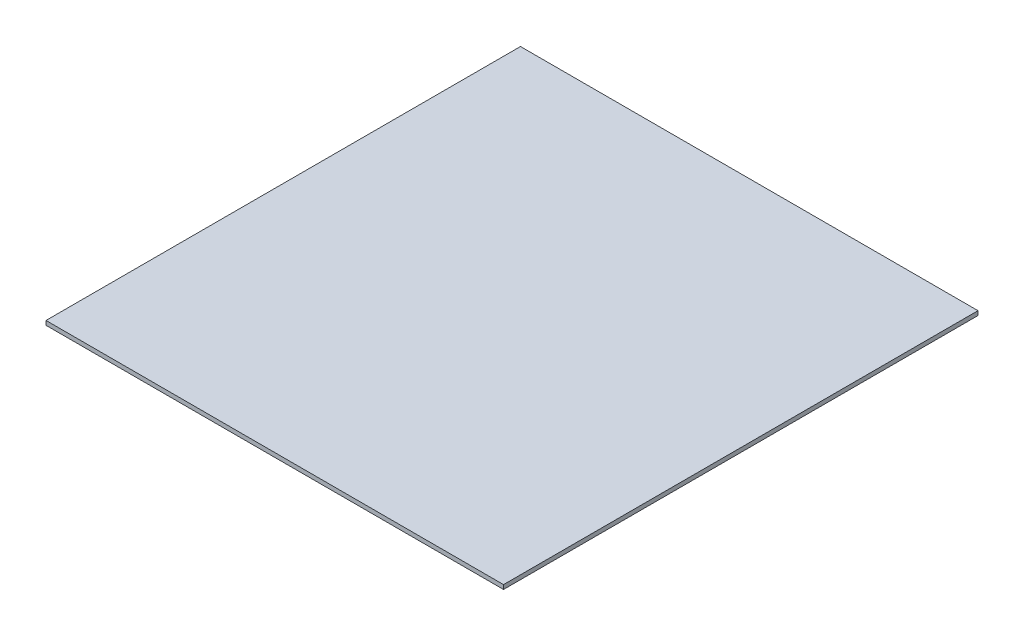
from build123d import *

# Parameters (mm, degrees)
SKETCH1_W           = 342.9
SKETCH1_H           = 355.6
BOSS_EXTRUDE1_DEPTH = 3.175


with BuildPart() as part:
    # Sketch1 → Boss-Extrude1 (new body)
    with BuildSketch(Plane(origin=(0, 0, 0), x_dir=(1, 0, 0), z_dir=(0, 1, 0))):
        with Locations((171.45, 177.8)):
            Rectangle(SKETCH1_W, SKETCH1_H)
    extrude(amount=BOSS_EXTRUDE1_DEPTH)


solid = part.part
